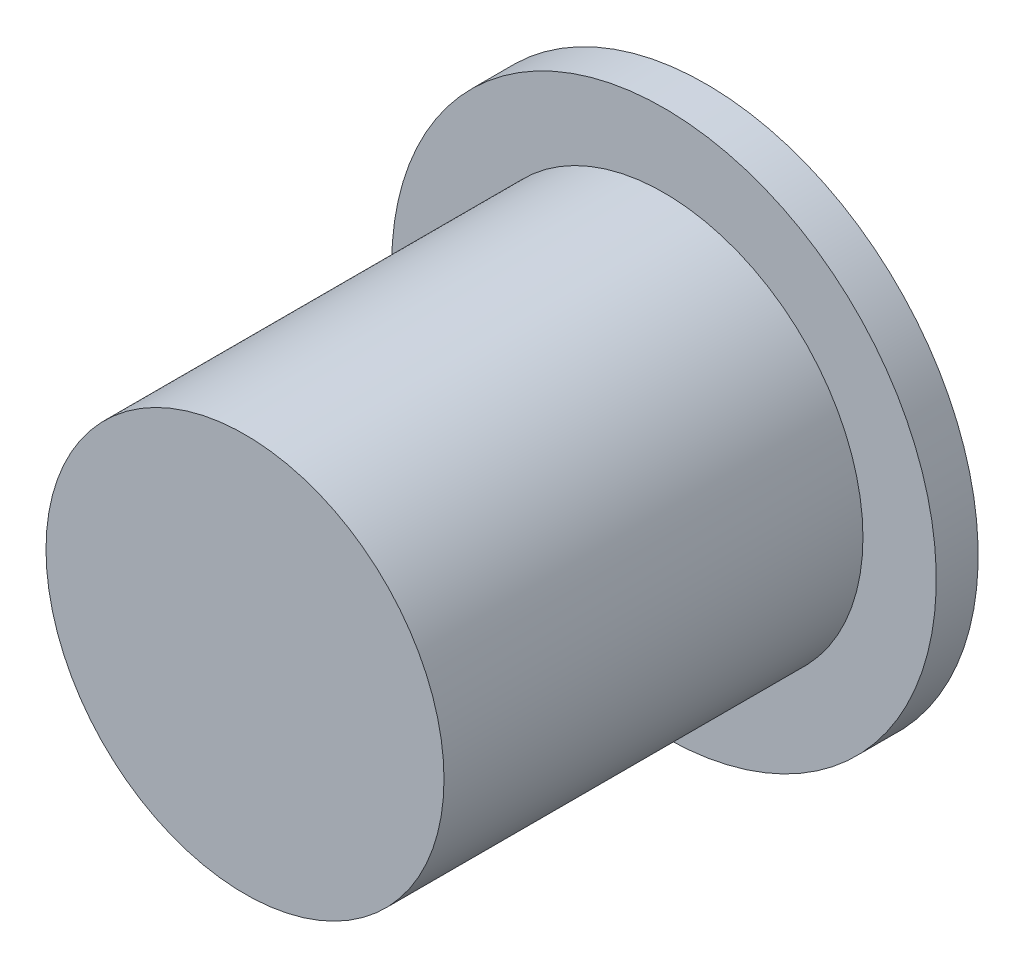
from build123d import *

# Parameters (mm, degrees)
SKETCH1_R           = 2.375
BOSS_EXTRUDE1_DEPTH = 5
SKETCH3_R           = 3.25
BOSS_EXTRUDE2_DEPTH = 0.5
SKETCH5_R           = 1.75
CUT_EXTRUDE1_DEPTH  = 0.25


with BuildPart() as part:
    # Sketch1 → Boss-Extrude1 (new body)
    with BuildSketch(Plane.XY):
        Circle(SKETCH1_R)
    extrude(amount=BOSS_EXTRUDE1_DEPTH)

    # Sketch3 → Boss-Extrude2 (add)
    with BuildSketch(Plane(origin=(0, 0, 0), x_dir=(-1, 0, 0), z_dir=(0, 0, -1))):
        Circle(SKETCH3_R)
    extrude(amount=BOSS_EXTRUDE2_DEPTH)

    # Sketch5 → Cut-Extrude1 (cut)
    with BuildSketch(Plane(origin=(0, 0, -0.5), x_dir=(-1, 0, 0), z_dir=(0, 0, -1))):
        Circle(SKETCH5_R)
    extrude(amount=-CUT_EXTRUDE1_DEPTH, mode=Mode.SUBTRACT)


solid = part.part
